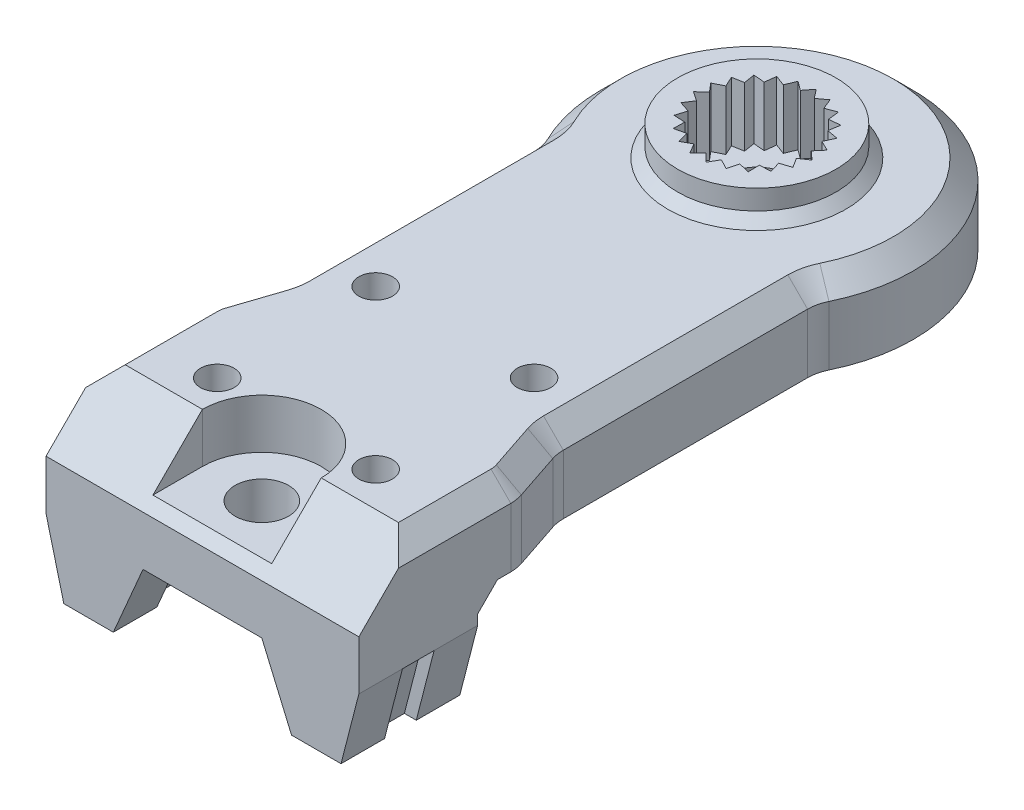
from build123d import *
from build123d.topology import SkipClean

# Parameters (mm, degrees)
EXTRUDE_1_DEPTH          = 4
EXTRUDE_3_DEPTH          = 6
CHAMFER_1_SIZE           = 3
SKETCH_5_R               = 0.85
CUT_EXTRUDE_1_DEPTH      = 4
PATTERN_LINEAR_1_COUNT   = 2
PATTERN_LINEAR_1_PITCH   = 8
CUT_EXTRUDE_2_DEPTH      = 2.5
CUT_EXTRUDE_3_REACH      = 31.81
SKETCH_7_R               = 1.35
SKETCH_9_R               = 3.25
CUT_EXTRUDE_4_DEPTH      = 1
SKETCH_10_R              = 4
EXTRUDE_4_DEPTH          = 1.5
CHAMFER_3_SIZE           = 0.5
SKETCH_11_R              = 3
CUT_EXTRUDE_5_DEPTH      = 3
SKETCH_12_R              = 1.55
CUT_EXTRUDE_6_DEPTH      = 30.705386717
EXTRUDE_5_DEPTH          = 3
PATTERN_CIRCULAR_1_COUNT = 23
CUT_EXTRUDE_7_DEPTH      = 0.8
CUT_EXTRUDE_8_DEPTH      = 31.453407034
FILLET_1_R               = 2
CHAMFER_2_SIZE           = 1


with BuildPart() as part:
    # ｽｹｯﾁ1 → ﾎﾞｽ - 押し出し1 (new body)
    with BuildSketch(Plane(origin=(0, 0, 0), x_dir=(1, 0, 0), z_dir=(0, 1, 0))):
        with BuildLine():
            Line((-7.9, 0), (-7.9, -28))
            Line((-7.9, -28), (7.9, -28))
            Line((7.9, -28), (7.9, 0))
            ThreePointArc((7.9, 0), (0, 7.9), (-7.9, 0))
        make_face()
    extrude(amount=EXTRUDE_1_DEPTH)

    # ｽｹｯﾁ4 → ﾎﾞｽ - 押し出し3 (add)
    with BuildSketch(Plane.XY.offset(28)):
        Polygon((-7, -5), (-4.5, -5), (-3, -1.5), (3, -1.5), (4.5, -5), (7, -5), (7.9, -1.5), (7.9, 0), (-7.9, 0), (-7.9, -1.5), align=None)
    extrude(amount=-EXTRUDE_3_DEPTH)

    # 面取り1
    chamfer_1_edges = [part.edges().sort_by_distance(p)[0] for p in [
        (0, 4, 28),
    ]]
    chamfer(chamfer_1_edges, length=CHAMFER_1_SIZE)

    # ｽｹｯﾁ5 → ｶｯﾄ - 押し出し1 (cut)
    with BuildSketch(Plane(origin=(0, 4, 0), x_dir=(1, 0, 0), z_dir=(0, 1, 0))):
        with Locations(Location((-4, -23.25, 0), (0, 0, 270))):
            Circle(SKETCH_5_R)
        with Locations(Location((4, -23.25, 0), (0, 0, 270))):
            Circle(SKETCH_5_R)
    cut_extrude_1 = extrude(amount=-CUT_EXTRUDE_1_DEPTH, mode=Mode.SUBTRACT)

    # 直線ﾊﾟﾀｰﾝ1: ｶｯﾄ - 押し出し1 ×2
    with Locations(*[(0, 0, -i * PATTERN_LINEAR_1_PITCH) for i in range(1, PATTERN_LINEAR_1_COUNT)]):
        add(cut_extrude_1, mode=Mode.SUBTRACT)

    # ｽｹｯﾁ6 → ｶｯﾄ - 押し出し2 (cut)
    with BuildSketch(Plane(origin=(0, 4, 0), x_dir=(1, 0, 0), z_dir=(0, 1, 0))):
        with BuildLine():
            Line((-3, -25), (-3, -29))
            Line((-3, -29), (3, -29))
            Line((3, -29), (3, -25))
            ThreePointArc((3, -25), (0, -22), (-3, -25))
        make_face()
    extrude(amount=-CUT_EXTRUDE_2_DEPTH, mode=Mode.SUBTRACT)

    # ｽｹｯﾁ7 → ｶｯﾄ - 押し出し3 (cut, up to next)
    with BuildSketch(Plane(origin=(0, 1.5, 0), x_dir=(1, 0, 0), z_dir=(0, 1, 0)), mode=Mode.PRIVATE) as cut_extrude_3_sk1:
        with Locations(Location((0, -25, 0), (0, 0, 270))):
            Circle(SKETCH_7_R)
    cut_extrude_3_tool1 = extrude(cut_extrude_3_sk1.sketch, amount=-CUT_EXTRUDE_3_REACH, mode=Mode.PRIVATE) & part.part
    add(cut_extrude_3_tool1.solids().sort_by_distance((0, 1.5, 25))[0], mode=Mode.SUBTRACT)

    # ｽｹｯﾁ9 → ｶｯﾄ - 押し出し4 (cut)
    with BuildSketch(Plane(origin=(0, 0, 0), x_dir=(1, 0, 0), z_dir=(0, 1, 0))):
        with Locations(Location((0, 0, 0), (0, 0, 270))):
            Circle(SKETCH_9_R)
    extrude(amount=CUT_EXTRUDE_4_DEPTH, mode=Mode.SUBTRACT)

    # ｽｹｯﾁ10 → ﾎﾞｽ - 押し出し4 (add)
    with BuildSketch(Plane(origin=(0, 4, 0), x_dir=(1, 0, 0), z_dir=(0, 1, 0))):
        with Locations(Location((0, 0, 0), (0, 0, 270))):
            Circle(SKETCH_10_R)
    extrude(amount=EXTRUDE_4_DEPTH)

    # 面取り3
    chamfer_3_edges = [part.edges().sort_by_distance(p)[0] for p in [
        (0, 4, -4),
    ]]
    chamfer(chamfer_3_edges, length=CHAMFER_3_SIZE)

    # ｽｹｯﾁ11 → ｶｯﾄ - 押し出し5 (cut)
    with BuildSketch(Plane(origin=(0, 5.5, 0), x_dir=(1, 0, 0), z_dir=(0, 1, 0))):
        with Locations(Location((0, 0, 0), (0, 0, 270))):
            Circle(SKETCH_11_R)
    extrude(amount=-CUT_EXTRUDE_5_DEPTH, mode=Mode.SUBTRACT)

    # ｽｹｯﾁ12 → ｶｯﾄ - 押し出し6 (cut, through all)
    with BuildSketch(Plane.XZ.offset(-1)):
        with Locations(Location((0, 0, 0), (0, 0, 270))):
            Circle(SKETCH_12_R)
    extrude(amount=-CUT_EXTRUDE_6_DEPTH, mode=Mode.SUBTRACT)

    # ｽｹｯﾁ13 → ﾎﾞｽ - 押し出し5 (add)
    with BuildSketch(Plane(origin=(0, 5.5, 0), x_dir=(1, 0, 0), z_dir=(0, 1, 0))):
        with BuildLine():
            Line((0.408499947, -2.972057838), (0, -2.574530741))
            Line((0, -2.574530741), (-0.408499947, -2.972057838))
            ThreePointArc((-0.408499947, -2.972057838), (0, -3), (0.408499947, -2.972057838))
        make_face()
    extrude_5 = extrude(amount=-EXTRUDE_5_DEPTH)

    # 円形ﾊﾟﾀｰﾝ1: ﾎﾞｽ - 押し出し5 ×23 about axis
    pattern_circular_1_axis = Axis((0, 0, 0), (0, 1, 0))
    for i in range(1, PATTERN_CIRCULAR_1_COUNT):
        add(extrude_5.rotate(pattern_circular_1_axis, i * 360 / PATTERN_CIRCULAR_1_COUNT))

    # ｽｹｯﾁ14 → ｶｯﾄ - 押し出し7 (cut, symmetric)
    with BuildSketch(Plane.XY.offset(25)):
        Polygon((3, -1.5), (4.5, -5), (5.1, -5), (3.6, -1.5), align=None)
        Polygon((6.4, -5), (7, -5), (7.9, -1.5), (7.3, -1.5), align=None)
    cut_extrude_7 = extrude(amount=CUT_EXTRUDE_7_DEPTH, both=True, mode=Mode.SUBTRACT)

    # ﾐﾗｰ1: ｶｯﾄ - 押し出し7 across plane
    add(cut_extrude_7.mirror(Plane(origin=(0, 0, 0), x_dir=(0, 0, 1), z_dir=(1, 0, 0))), mode=Mode.SUBTRACT)

    # ｽｹｯﾁ15 → ｶｯﾄ - 押し出し8 (cut, through all)
    with SkipClean():  # the faces are left unmerged after this step: merging them gives an invalid solid
        with BuildSketch(Plane(origin=(0, 4, 0), x_dir=(1, 0, 0), z_dir=(0, 1, 0))):
            with BuildLine():
                Line((-7.9, 0), (-7.9, -20))
                Line((-7.9, -20), (-6.9, -17))
                Line((-6.9, -17), (-6.9, -3.847076812))
                ThreePointArc((-6.9, -3.847076812), (-7.645913941, -1.987460691), (-7.9, 0))
            make_face()
        cut_extrude_8 = extrude(amount=-CUT_EXTRUDE_8_DEPTH, mode=Mode.SUBTRACT)

    # ﾐﾗｰ2: ｶｯﾄ - 押し出し8 across plane
    with SkipClean():  # the faces are left unmerged after this step: merging them gives an invalid solid
        add(cut_extrude_8.mirror(Plane(origin=(0, 0, 0), x_dir=(0, 0, 1), z_dir=(1, 0, 0))), mode=Mode.SUBTRACT)

    # ﾌｨﾚｯﾄ1
    fillet_1_edges = [part.edges().sort_by_distance(p)[0] for p in [
        (-6.9, 2, 3.847076812),
        (-6.9, 2, 17),
        (-7.9, 2, 20),
        (6.9, 2, 3.847076812),
        (7.9, 2, 20),
        (6.9, 2, 17),
    ]]
    fillet(fillet_1_edges, radius=FILLET_1_R)

    # 面取り2
    chamfer_2_edges = [part.edges().sort_by_distance(p)[0] for p in [
        (-7.9, 4, 22.66227766),
        (0, 4, -7.9),
        (7.9, 4, 22.66227766),
        (0, 0, 22),
        (-7.874174915, 4, 20.004190834),
        (-7.4, 4, 18.5),
        (-6.925825085, 4, 16.995809166),
        (-6.9, 4, 10.505670679),
        (-6.951159371, 4, 3.886430103),
        (6.951159371, 4, 3.886430103),
        (6.9, 4, 10.505670679),
        (6.925825085, 4, 16.995809166),
        (7.4, 4, 18.5),
        (7.874174915, 4, 20.004190834),
    ]]
    chamfer(chamfer_2_edges, length=CHAMFER_2_SIZE)


solid = part.part
